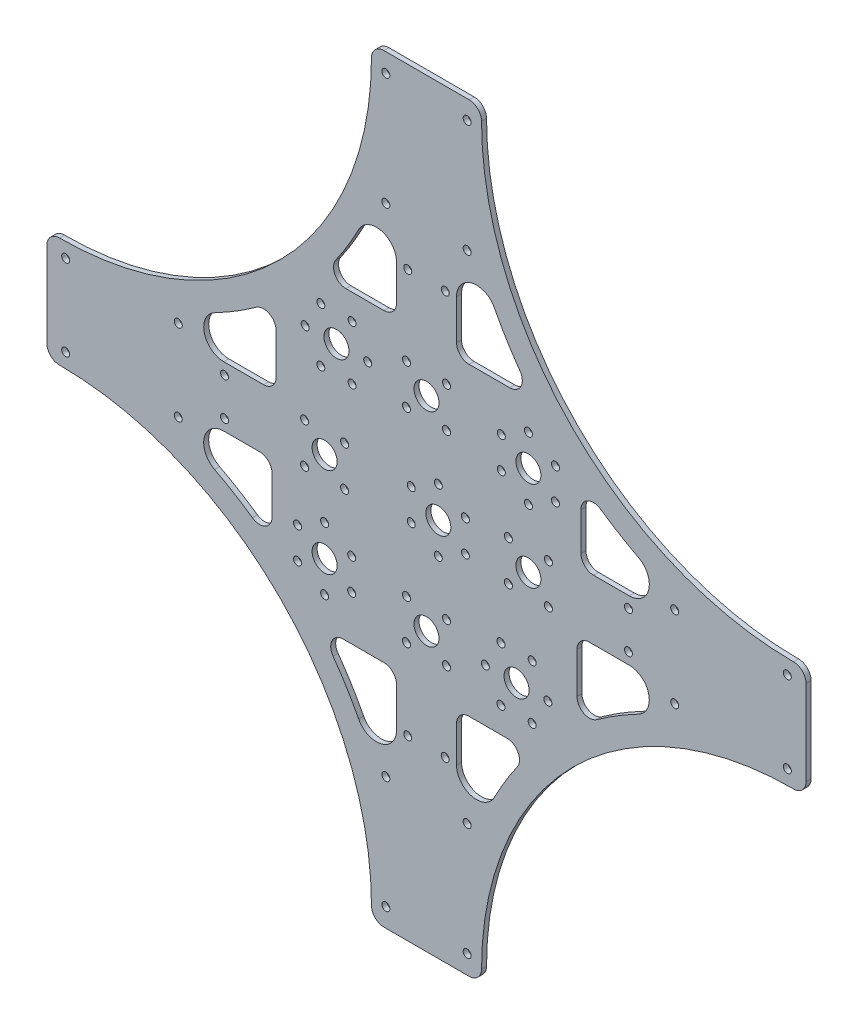
from build123d import *

# Parameters (mm, degrees)
BOSS_EXTRUDE1_DEPTH = 2
SKETCH2_R           = 5
CUT_EXTRUDE1_DEPTH  = 2
SKETCH3_R           = 5
SKETCH3_R_2         = 1.6
CUT_EXTRUDE2_DEPTH  = 2
BOSS_EXTRUDE3_DEPTH = 2
CIRPATTERN1_COUNT   = 4
SKETCH5_R           = 1.615581179
CUT_EXTRUDE3_DEPTH  = 2
CIRPATTERN2_COUNT   = 4
SKETCH6_R           = 1.580180207
SKETCH6_R_2         = 1.6
CUT_EXTRUDE4_DEPTH  = 2
CIRPATTERN3_COUNT   = 4


with BuildPart() as part:
    # Sketch1 → Boss-Extrude1 (new body)
    with BuildSketch(Plane.XY):
        with BuildLine():
            Line((71.228993619, -85.582665129), (71.228993619, -51.582665129))
            ThreePointArc((71.228993619, -51.582665129), (69.764527525, -48.047131224), (66.228993619, -46.582665129))
            Line((66.228993619, -46.582665129), (-5.667209242, -46.582665129))
            ThreePointArc((-5.667209242, -46.582665129), (-25.346028045, -13.428336197), (-58.500356977, 6.250482606))
            Line((-58.500356977, 6.250482606), (-58.500356977, 78.146685467))
            ThreePointArc((-58.500356977, 78.146685467), (-59.964823071, 81.682219373), (-63.500356977, 83.146685467))
            Line((-63.500356977, 83.146685467), (-97.500356977, 83.146685467))
            ThreePointArc((-97.500356977, 83.146685467), (-101.035890883, 81.682219373), (-102.500356977, 78.146685467))
            Line((-102.500356977, 78.146685467), (-102.500356977, 6.250482606))
            ThreePointArc((-102.500356977, 6.250482606), (-135.65468591, -13.428336197), (-155.333504713, -46.582665129))
            Line((-155.333504713, -46.582665129), (-227.229707574, -46.582665129))
            ThreePointArc((-227.229707574, -46.582665129), (-230.76524148, -48.047131224), (-232.229707574, -51.582665129))
            Line((-232.229707574, -51.582665129), (-232.229707574, -85.582665129))
            ThreePointArc((-232.229707574, -85.582665129), (-230.76524148, -89.118199035), (-227.229707574, -90.582665129))
            Line((-227.229707574, -90.582665129), (-155.333504713, -90.582665129))
            ThreePointArc((-155.333504713, -90.582665129), (-135.65468591, -123.736994062), (-102.500356977, -143.415812865))
            Line((-102.500356977, -143.415812865), (-102.500356977, -215.312015726))
            ThreePointArc((-102.500356977, -215.312015726), (-101.035890883, -218.847549632), (-97.500356977, -220.312015726))
            Line((-97.500356977, -220.312015726), (-63.500356977, -220.312015726))
            ThreePointArc((-63.500356977, -220.312015726), (-59.964823071, -218.847549632), (-58.500356977, -215.312015726))
            Line((-58.500356977, -215.312015726), (-58.500356977, -143.415812865))
            ThreePointArc((-58.500356977, -143.415812865), (-25.346028045, -123.736994062), (-5.667209242, -90.582665129))
            Line((-5.667209242, -90.582665129), (66.228993619, -90.582665129))
            ThreePointArc((66.228993619, -90.582665129), (69.764527525, -89.118199035), (71.228993619, -85.582665129))
        make_face()
    extrude(amount=BOSS_EXTRUDE1_DEPTH)

    # Sketch2 → Cut-Extrude1 (cut)
    with BuildSketch(Plane.XY.offset(2)):
        with Locations((-39.771006381, -68.582665129)):
            Circle(SKETCH2_R)
        with Locations((-80.500356977, -109.312015726)):
            Circle(SKETCH2_R)
        with Locations((-121.229707574, -68.582665129)):
            Circle(SKETCH2_R)
        with Locations((-80.500356977, -27.853314533)):
            Circle(SKETCH2_R)
    extrude(amount=-CUT_EXTRUDE1_DEPTH, mode=Mode.SUBTRACT)

    # Sketch3 → Cut-Extrude2 (cut)
    with BuildSketch(Plane.XY.offset(2)):
        with Locations((-39.771006381, -32.582665129)):
            Circle(SKETCH3_R)
        with Locations((-75.771006381, -68.582665129)):
            Circle(SKETCH3_R)
        with Locations((-39.771006381, -20.082665129)):
            Circle(SKETCH3_R_2)
        with Locations((-28.945688834, -26.332665129)):
            Circle(SKETCH3_R_2)
        with Locations((-28.945688834, -38.832665129)):
            Circle(SKETCH3_R_2)
        with Locations((-39.771006381, -45.082665129)):
            Circle(SKETCH3_R_2)
        with Locations((-50.596323928, -38.832665129)):
            Circle(SKETCH3_R_2)
        with Locations((-50.596323928, -26.332665129)):
            Circle(SKETCH3_R_2)
        with Locations((-75.771006381, -56.082665129)):
            Circle(SKETCH3_R_2)
        with Locations((-86.596323928, -74.832665129)):
            Circle(SKETCH3_R_2)
        with Locations((-64.945688834, -74.832665129)):
            Circle(SKETCH3_R_2)
        with Locations((-86.596323928, -62.332665129)):
            Circle(SKETCH3_R_2)
        with Locations((-75.771006381, -81.082665129)):
            Circle(SKETCH3_R_2)
        with Locations((-64.945688834, -62.332665129)):
            Circle(SKETCH3_R_2)
        with Locations((-44.500356977, -109.312015726)):
            Circle(SKETCH3_R)
        with Locations((-32.000356977, -109.312015726)):
            Circle(SKETCH3_R_2)
        with Locations((-38.250356977, -120.137333273)):
            Circle(SKETCH3_R_2)
        with Locations((-50.750356977, -120.137333273)):
            Circle(SKETCH3_R_2)
        with Locations((-57.000356977, -109.312015726)):
            Circle(SKETCH3_R_2)
        with Locations((-50.750356977, -98.486698178)):
            Circle(SKETCH3_R_2)
        with Locations((-38.250356977, -98.486698178)):
            Circle(SKETCH3_R_2)
        with Locations((-121.229707574, -104.582665129)):
            Circle(SKETCH3_R)
        with Locations((-121.229707574, -117.082665129)):
            Circle(SKETCH3_R_2)
        with Locations((-132.055025121, -110.832665129)):
            Circle(SKETCH3_R_2)
        with Locations((-132.055025121, -98.332665129)):
            Circle(SKETCH3_R_2)
        with Locations((-121.229707574, -92.082665129)):
            Circle(SKETCH3_R_2)
        with Locations((-110.404390026, -98.332665129)):
            Circle(SKETCH3_R_2)
        with Locations((-110.404390026, -110.832665129)):
            Circle(SKETCH3_R_2)
        with Locations((-116.500356977, -27.853314533)):
            Circle(SKETCH3_R)
        with Locations((-129.000356977, -27.853314533)):
            Circle(SKETCH3_R_2)
        with Locations((-122.750356977, -17.027996986)):
            Circle(SKETCH3_R_2)
        with Locations((-110.250356977, -17.027996986)):
            Circle(SKETCH3_R_2)
        with Locations((-104.000356977, -27.853314533)):
            Circle(SKETCH3_R_2)
        with Locations((-110.250356977, -38.67863208)):
            Circle(SKETCH3_R_2)
        with Locations((-122.750356977, -38.67863208)):
            Circle(SKETCH3_R_2)
    extrude(amount=-CUT_EXTRUDE2_DEPTH, mode=Mode.SUBTRACT)

    # Sketch4 → Boss-Extrude3 (add)
    with BuildSketch(Plane.XY.offset(2)):
        with BuildLine():
            Line((66.228993619, -46.582665129), (-5.667209242, -46.582665129))
            Line((-5.667209242, -46.582665129), (-58.500356977, 6.250482606))
            Line((-58.500356977, 6.250482606), (-58.500356977, 78.146685467))
            ThreePointArc((-58.500356977, 78.146685467), (-21.967976001, -10.050284153), (66.228993619, -46.582665129))
        make_face()
    boss_extrude3 = extrude(amount=-BOSS_EXTRUDE3_DEPTH)

    # CirPattern1: Boss-Extrude3 ×4 about axis
    cirpattern1_axis = Axis((-80.500356977, -68.582665129, 62.481201405), (0, 0, -1))
    for i in range(1, CIRPATTERN1_COUNT):
        add(boss_extrude3.rotate(cirpattern1_axis, i * 360 / CIRPATTERN1_COUNT))

    # Sketch5 → Cut-Extrude3 (cut)
    with BuildSketch(Plane.XY.offset(2)):
        with Locations((-72.500356977, -19.853314533)):
            Circle(SKETCH5_R)
        with Locations((-72.500356977, -35.853314533)):
            Circle(SKETCH5_R)
        with Locations((-88.500356977, -35.853314533)):
            Circle(SKETCH5_R)
        with Locations((-88.500356977, -19.853314533)):
            Circle(SKETCH5_R)
        with BuildLine():
            Line((0.568204566, -56.582665129), (-13.771006381, -56.582665129))
            ThreePointArc((-13.771006381, -56.582665129), (-17.306540287, -55.118199035), (-18.771006381, -51.582665129))
            Line((-18.771006381, -51.582665129), (-18.771006381, -36.41461436))
            ThreePointArc((-18.771006381, -36.41461436), (-16.082565913, -31.98102749), (-10.908329368, -32.315214365))
            ThreePointArc((-10.908329368, -32.315214365), (-3.480672437, -37.146681083), (4.248500947, -41.47946736))
            ThreePointArc((4.248500947, -41.47946736), (8.340771135, -50.476657981), (0.568204566, -56.582665129))
        make_face()
        with BuildLine():
            Line((-68.490992753, -3.441767926), (-68.490992753, 12.46782604))
            ThreePointArc((-68.490992753, 12.46782604), (-62.385539766, 20.240257552), (-53.388319849, 16.149135267))
            ThreePointArc((-53.388319849, 16.149135267), (-48.570892, 7.627296828), (-43.147404283, -0.52225055))
            ThreePointArc((-43.147404283, -0.52225055), (-42.756936227, -5.722383317), (-47.20651974, -8.441767926))
            Line((-47.20651974, -8.441767926), (-63.490992753, -8.441767926))
            ThreePointArc((-63.490992753, -8.441767926), (-67.026526659, -6.977301832), (-68.490992753, -3.441767926))
        make_face()
    cut_extrude3 = extrude(amount=-CUT_EXTRUDE3_DEPTH, mode=Mode.SUBTRACT)

    # CirPattern2: Cut-Extrude3 ×4 about axis
    cirpattern2_axis = Axis((-80.500356977, -68.582665129, 62.481201405), (0, 0, -1))
    for i in range(1, CIRPATTERN2_COUNT):
        add(cut_extrude3.rotate(cirpattern2_axis, i * 360 / CIRPATTERN2_COUNT), mode=Mode.SUBTRACT)

    # Sketch6 → Cut-Extrude4 (cut)
    with BuildSketch(Plane.XY.offset(2)):
        with Locations((0.228993619, -76.092029354)):
            Circle(SKETCH6_R)
        with Locations((0.228993619, -61.092029354)):
            Circle(SKETCH6_R_2)
        with Locations((18.728993619, -52.332665129)):
            Circle(SKETCH6_R_2)
        with Locations((63.728993619, -52.332665129)):
            Circle(SKETCH6_R_2)
        with Locations((63.728993619, -84.832665129)):
            Circle(SKETCH6_R_2)
        with Locations((18.728993619, -84.832665129)):
            Circle(SKETCH6_R_2)
    cut_extrude4 = extrude(amount=-CUT_EXTRUDE4_DEPTH, mode=Mode.SUBTRACT)

    # CirPattern3: Cut-Extrude4 ×4 about axis
    cirpattern3_axis = Axis((-80.500356977, -68.582665129, 62.481201405), (0, 0, -1))
    for i in range(1, CIRPATTERN3_COUNT):
        add(cut_extrude4.rotate(cirpattern3_axis, i * 360 / CIRPATTERN3_COUNT), mode=Mode.SUBTRACT)


solid = part.part
